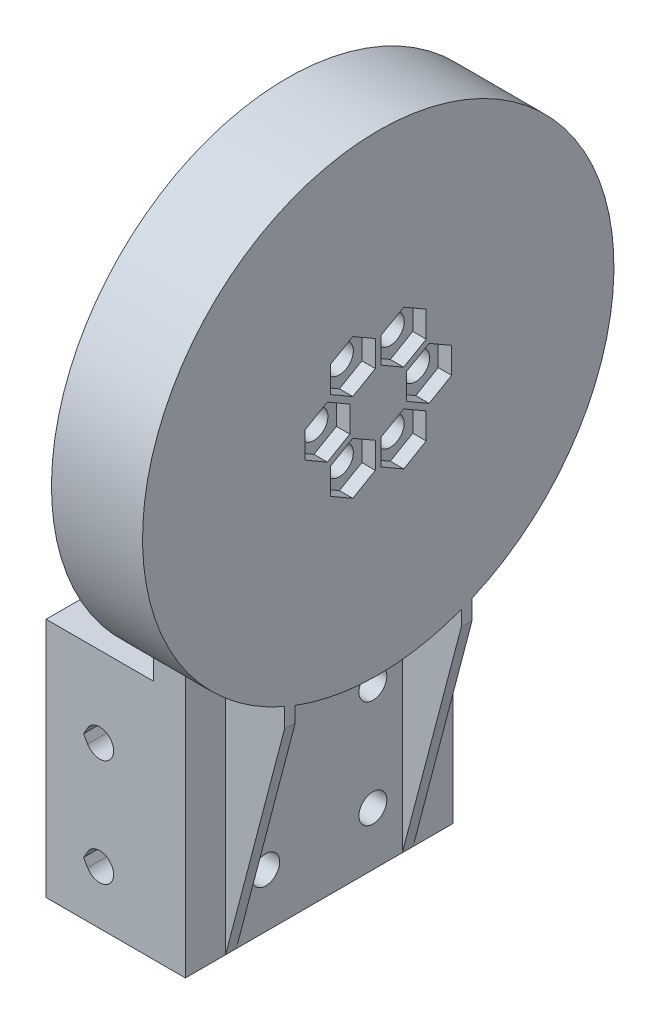
from build123d import *

# Parameters (mm, degrees)
SKETCH1_R                = 44
SKETCH1_R_2              = 2.6
BOSS_EXTRUDE1_DEPTH      = 5
BOSS_EXTRUDE2_START      = -4.5
SKETCH1_3_R              = 44
SKETCH1_3_R_2            = 22.5
BOSS_EXTRUDE2_DEPTH      = 4.5
BOSS_EXTRUDE3_START      = 7.5
SKETCH2_R                = 44
SKETCH2_R_2              = 37.7
BOSS_EXTRUDE3_DEPTH      = 7.5
BOSS_EXTRUDE4_DEPTH      = 6
SKETCH4_R                = 35.25
CUT_EXTRUDE1_DEPTH       = 1
BOSS_EXTRUDE5_DEPTH      = 20
BOSS_EXTRUDE7_DEPTH      = 1
BOSS_EXTRUDE7_DEPTH_BACK = 1
BOSS_EXTRUDE8_DEPTH      = 1
BOSS_EXTRUDE8_DEPTH_BACK = 1
SKETCH8_R                = 2.6
CUT_EXTRUDE2_DEPTH       = 101.039992003
CUT_EXTRUDE3_DEPTH       = 115.808536268
CUT_EXTRUDE4_DEPTH       = 2.5


with BuildPart() as part:
    # Sketch1 → Boss-Extrude1 (new body)
    with BuildSketch(Plane(origin=(0, 0, 0), x_dir=(0, 0, -1), z_dir=(1, 0, 0))):
        Circle(SKETCH1_R)
        with Locations((-4.75, -8.227241336)):
            Circle(SKETCH1_R_2, mode=Mode.SUBTRACT)
        with Locations((4.75, -8.227241336)):
            Circle(SKETCH1_R_2, mode=Mode.SUBTRACT)
        with Locations((9.5, 0)):
            Circle(SKETCH1_R_2, mode=Mode.SUBTRACT)
        with Locations((-9.5, 0)):
            Circle(SKETCH1_R_2, mode=Mode.SUBTRACT)
        with Locations((-4.75, 8.227241336)):
            Circle(SKETCH1_R_2, mode=Mode.SUBTRACT)
        with Locations((4.75, 8.227241336)):
            Circle(SKETCH1_R_2, mode=Mode.SUBTRACT)
    extrude(amount=BOSS_EXTRUDE1_DEPTH)

    # Sketch1<3> → Boss-Extrude2 (add)
    with BuildSketch(Plane(origin=(0, 0, 0), x_dir=(0, 0, -1), z_dir=(1, 0, 0)).offset(BOSS_EXTRUDE2_START)):
        Circle(SKETCH1_3_R)
        Circle(SKETCH1_3_R_2, mode=Mode.SUBTRACT)
    extrude(amount=BOSS_EXTRUDE2_DEPTH)

    # Sketch2 → Boss-Extrude3 (add)
    with BuildSketch(Plane.ZY.offset(4.5).offset(BOSS_EXTRUDE3_START)):
        Circle(SKETCH2_R)
        Circle(SKETCH2_R_2, mode=Mode.SUBTRACT)
    extrude(amount=-BOSS_EXTRUDE3_DEPTH)

    # Sketch3 → Boss-Extrude4 (add)
    with BuildSketch(Plane.ZY.offset(12)):
        with BuildLine():
            Line((-25, -86), (25, -86))
            Line((25, -86), (25, -36.20773398))
            ThreePointArc((25, -36.20773398), (0, -44), (-25, -36.20773398))
            Line((-25, -36.20773398), (-25, -86))
        make_face()
    extrude(amount=-BOSS_EXTRUDE4_DEPTH)

    # Sketch4 → Cut-Extrude1 (cut)
    with BuildSketch(Plane.ZY.offset(4.5)):
        Circle(SKETCH4_R)
    extrude(amount=-CUT_EXTRUDE1_DEPTH, mode=Mode.SUBTRACT)

    # Sketch5 → Boss-Extrude5 (add)
    with BuildSketch(Plane.ZY.offset(12)):
        Polygon((-25, -41), (-25, -86), (-20, -86), (-20, -46), (20, -46), (20, -86), (25, -86), (25, -41), align=None)
    extrude(amount=BOSS_EXTRUDE5_DEPTH)

    # Sketch6 → Boss-Extrude7 (add, two sides: drawn at the far end of the back side and taken through both)
    with BuildSketch(Plane.XY.offset(16.5).offset(-BOSS_EXTRUDE7_DEPTH_BACK)):
        Polygon((5, -40), (-6, -40), (-6, -86), (5, -44), align=None)
    extrude(amount=BOSS_EXTRUDE7_DEPTH + BOSS_EXTRUDE7_DEPTH_BACK)

    # Sketch7 → Boss-Extrude8 (add, two sides: drawn at the far end of the back side and taken through both)
    with BuildSketch(Plane(origin=(0, 0, -16.5), x_dir=(-1, 0, 0), z_dir=(0, 0, -1)).offset(-BOSS_EXTRUDE8_DEPTH_BACK)):
        Polygon((-5, -40), (6, -40), (6, -86), (-5, -44), align=None)
    extrude(amount=BOSS_EXTRUDE8_DEPTH + BOSS_EXTRUDE8_DEPTH_BACK)

    # Sketch8 → Cut-Extrude2 (cut, through all)
    with BuildSketch(Plane(origin=(-6, 0, 0), x_dir=(0, 0, -1), z_dir=(1, 0, 0))):
        with Locations((-10, -76)):
            Circle(SKETCH8_R)
        with Locations((10, -76)):
            Circle(SKETCH8_R)
        with Locations((-10, -56)):
            Circle(SKETCH8_R)
        with Locations((10, -56)):
            Circle(SKETCH8_R)
    extrude(amount=-CUT_EXTRUDE2_DEPTH, mode=Mode.SUBTRACT)

    # Sketch9 → Cut-Extrude3 (cut, through all)
    with BuildSketch(Plane.XY.offset(25)):
        with BuildLine():
            Line((-25, -56), (-24.253333333, -57.297107894))
            ThreePointArc((-24.253333333, -57.297107894), (-19.4, -56), (-24.253333333, -54.702892106))
            Line((-24.253333333, -54.702892106), (-25, -56))
        make_face()
        with BuildLine():
            Line((-25, -76), (-24.253333333, -77.297107894))
            ThreePointArc((-24.253333333, -77.297107894), (-19.4, -76), (-24.253333333, -74.702892106))
            Line((-24.253333333, -74.702892106), (-25, -76))
        make_face()
    extrude(amount=-CUT_EXTRUDE3_DEPTH, mode=Mode.SUBTRACT)

    # Sketch10 → Cut-Extrude4 (cut)
    with BuildSketch(Plane(origin=(5, 0, 0), x_dir=(0, 0, -1), z_dir=(1, 0, 0))):
        Polygon((9.5, -4.849742261), (13.7, -2.424871131), (13.7, 2.424871131), (9.5, 4.849742261), (5.3, 2.424871131), (5.3, -2.424871131), align=None)
        Polygon((8.95, 5.802370205), (8.95, 10.652112467), (4.75, 13.076983597), (0.55, 10.652112467), (0.55, 5.802370205), (4.75, 3.377499075), align=None)
        Polygon((0.55, -10.652112467), (4.75, -13.076983597), (8.95, -10.652112467), (8.95, -5.802370205), (4.75, -3.377499075), (0.55, -5.802370205), align=None)
        Polygon((-8.95, -5.802370205), (-8.95, -10.652112467), (-4.75, -13.076983597), (-0.55, -10.652112467), (-0.55, -5.802370205), (-4.75, -3.377499075), align=None)
        Polygon((-9.5, 4.849742261), (-13.7, 2.424871131), (-13.7, -2.424871131), (-9.5, -4.849742261), (-5.3, -2.424871131), (-5.3, 2.424871131), align=None)
        Polygon((-0.55, 10.652112467), (-4.75, 13.076983597), (-8.95, 10.652112467), (-8.95, 5.802370205), (-4.75, 3.377499075), (-0.55, 5.802370205), align=None)
    extrude(amount=-CUT_EXTRUDE4_DEPTH, mode=Mode.SUBTRACT)


solid = part.part
